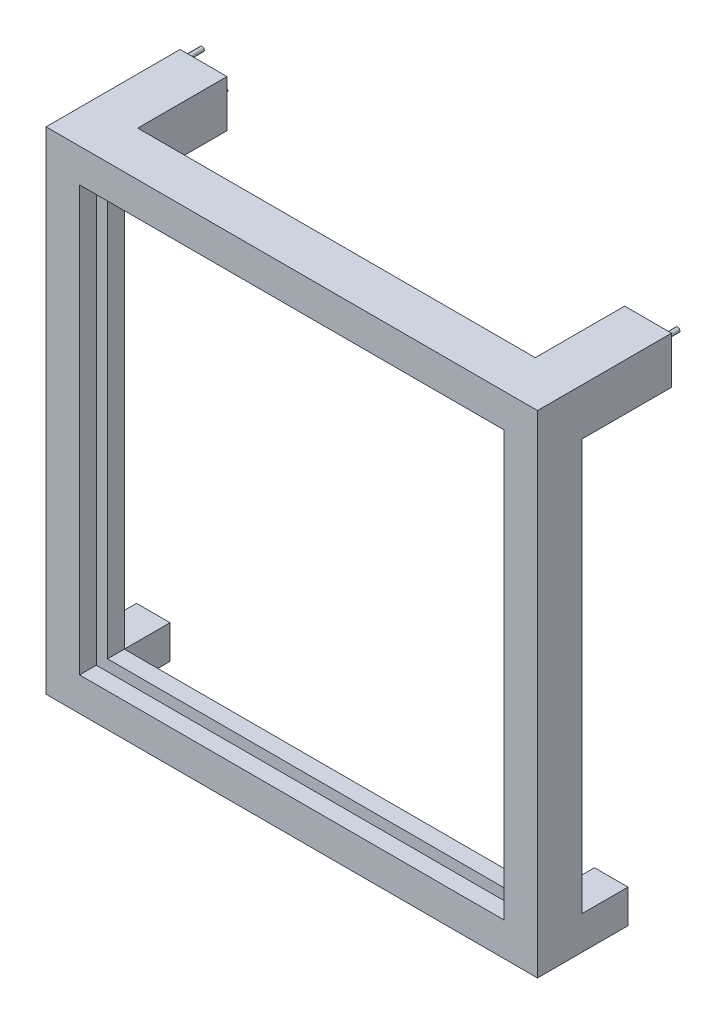
from build123d import *

# Parameters (mm, degrees)
ESQUISSE1_W                  = 440
ESQUISSE1_H                  = 440
ESQUISSE1_W_2                = 380
ESQUISSE1_H_2                = 380
BOSS_EXTRU_1_DEPTH           = 40
ENL_V_MAT_EXTRU_1_DEPTH      = 390
ENL_V_MAT_EXTRU_1_DEPTH_BACK = 10
ESQUISSE2_W                  = 400
ESQUISSE2_H                  = 10
ESQUISSE3_W                  = 42
ESQUISSE3_H                  = 42
BOSS_EXTRU_2_DEPTH           = 80
ESQUISSE5_R                  = 2
BOSS_EXTRU_3_DEPTH           = 15
ESQUISSE7_R                  = 4
ENL_V_MAT_EXTRU_2_DEPTH      = 20
ESQUISSE8_W                  = 30
ESQUISSE8_H                  = 30
BOSS_EXTRU_4_DEPTH           = 41


with BuildPart() as part:
    # Esquisse1 → Boss.-Extru.1 (new body)
    with BuildSketch(Plane.XY):
        Rectangle(ESQUISSE1_W, ESQUISSE1_H)
        Rectangle(ESQUISSE1_W_2, ESQUISSE1_H_2, mode=Mode.SUBTRACT)
    extrude(amount=BOSS_EXTRU_1_DEPTH)

    # Esquisse2 → Enlèv. mat.-Extru.1 (cut, two sides: drawn at the far end of the back side and taken through both)
    with BuildSketch(Plane(origin=(0, -190, 0), x_dir=(1, 0, 0), z_dir=(0, 1, 0)).offset(-ENL_V_MAT_EXTRU_1_DEPTH_BACK)):
        with Locations((0, -20)):
            Rectangle(ESQUISSE2_W, ESQUISSE2_H)
    extrude(amount=ENL_V_MAT_EXTRU_1_DEPTH + ENL_V_MAT_EXTRU_1_DEPTH_BACK, mode=Mode.SUBTRACT)

    # Esquisse3 → Boss.-Extru.2 (add)
    with BuildSketch(Plane(origin=(0, 0, 0), x_dir=(-1, 0, 0), z_dir=(0, 0, -1))):
        with Locations((-199, 199)):
            Rectangle(ESQUISSE3_W, ESQUISSE3_H)
        with Locations((199, 199)):
            Rectangle(ESQUISSE3_W, ESQUISSE3_H)
    extrude(amount=BOSS_EXTRU_2_DEPTH)

    # Esquisse5 → Boss.-Extru.3 (add)
    with BuildSketch(Plane(origin=(0, 0, -80), x_dir=(-1, 0, 0), z_dir=(0, 0, -1))):
        with Locations((-210.505010618, 210.505010618)):
            Circle(ESQUISSE5_R)
        with Locations((-189.505010618, 189.505010618)):
            Circle(ESQUISSE5_R)
        with Locations(Location((215.288490097, 215.288490097, 0), (0, 0, 180))):
            Circle(ESQUISSE5_R)
        with Locations(Location((194.288490097, 194.288490097, 0), (0, 0, 180))):
            Circle(ESQUISSE5_R)
    extrude(amount=BOSS_EXTRU_3_DEPTH)

    # Esquisse7 → Enlèv. mat.-Extru.2 (cut)
    with BuildSketch(Plane.XZ.offset(-178)):
        with Locations(Location((199, -60.5, 0), (0, 0, 270))):
            Circle(ESQUISSE7_R)
        with Locations(Location((-199, -60.5, 0), (0, 0, 270))):
            Circle(ESQUISSE7_R)
    extrude(amount=-ENL_V_MAT_EXTRU_2_DEPTH, mode=Mode.SUBTRACT)

    # Esquisse8 → Boss.-Extru.4 (add)
    with BuildSketch(Plane(origin=(0, 0, 0), x_dir=(-1, 0, 0), z_dir=(0, 0, -1))):
        with Locations((-205, -205)):
            Rectangle(ESQUISSE8_W, ESQUISSE8_H)
        with Locations((205, -205)):
            Rectangle(ESQUISSE8_W, ESQUISSE8_H)
    extrude(amount=BOSS_EXTRU_4_DEPTH)


solid = part.part
